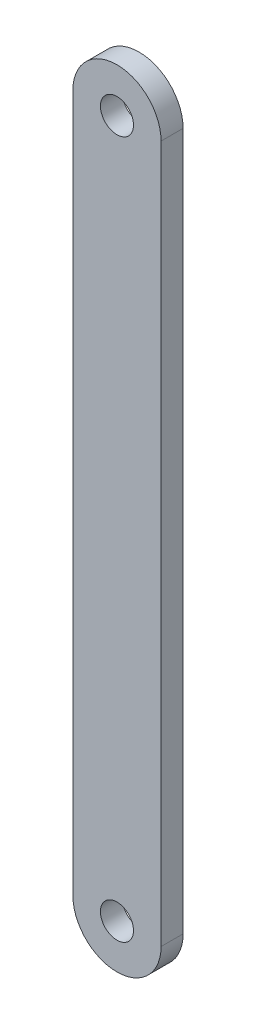
from build123d import *

# Parameters (mm, degrees)
SKETCH1_R           = 0.762
BOSS_EXTRUDE1_DEPTH = 1.016


with BuildPart() as part:
    # Sketch1 → Boss-Extrude1 (new body)
    with BuildSketch(Plane.XY):
        with BuildLine():
            Line((0, 0), (0, 32.1564))
            ThreePointArc((0, 32.1564), (2.032, 34.1884), (4.064, 32.1564))
            Line((4.064, 32.1564), (4.064, 0))
            ThreePointArc((4.064, 0), (2.032, -2.032), (0, 0))
        make_face()
        with Locations((2.032, 32.1564)):
            Circle(SKETCH1_R, mode=Mode.SUBTRACT)
        with Locations((2.032, 0)):
            Circle(SKETCH1_R, mode=Mode.SUBTRACT)
    extrude(amount=BOSS_EXTRUDE1_DEPTH)


solid = part.part
